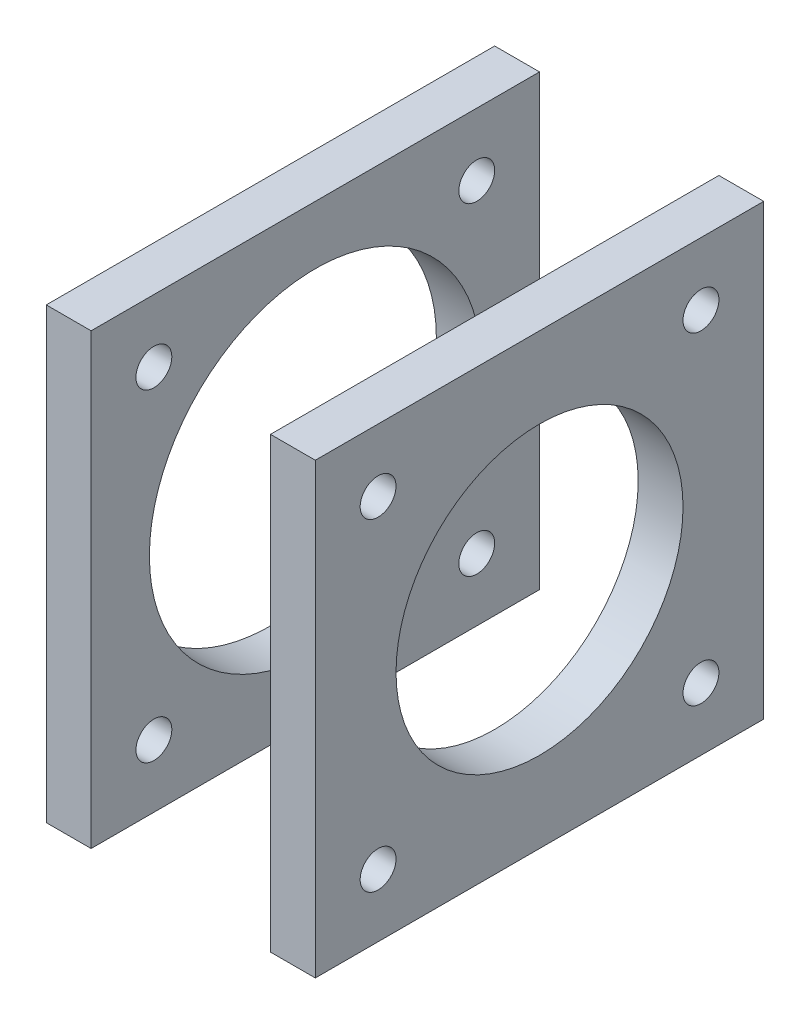
from build123d import *

# Parameters (mm, degrees)
SKETCH1_W           = 50
SKETCH1_H           = 50
SKETCH1_R           = 2
SKETCH1_R_2         = 18.5
BOSS_EXTRUDE1_DEPTH = 5
SKETCH4_W           = 50
SKETCH4_H           = 50
SKETCH4_R           = 2
SKETCH4_R_2         = 16
BOSS_EXTRUDE2_DEPTH = 5


with BuildPart() as part:
    # Sketch1 → Boss-Extrude1 (new body)
    with BuildSketch(Plane(origin=(0, 0, 0), x_dir=(0, 0, -1), z_dir=(1, 0, 0))):
        with Locations((7.569218273, -6.915532209)):
            Rectangle(SKETCH1_W, SKETCH1_H)
        with Locations((-10.430781727, 11.084467791)):
            Circle(SKETCH1_R, mode=Mode.SUBTRACT)
        with Locations(Location((-10.430781727, -24.915532209, 0), (0, 0, 180))):
            Circle(SKETCH1_R, mode=Mode.SUBTRACT)
        with Locations((25.569218273, -24.915532209)):
            Circle(SKETCH1_R, mode=Mode.SUBTRACT)
        with Locations(Location((25.569218273, 11.084467791, 0), (0, 0, 180))):
            Circle(SKETCH1_R, mode=Mode.SUBTRACT)
        with Locations((7.569218273, -6.915532209)):
            Circle(SKETCH1_R_2, mode=Mode.SUBTRACT)
    extrude(amount=BOSS_EXTRUDE1_DEPTH)


with BuildPart() as body_2:
    # Sketch4 → Boss-Extrude2 (new body)
    with BuildSketch(Plane(origin=(25, 0, 0), x_dir=(0, 0, -1), z_dir=(1, 0, 0))):
        with Locations((7.569218273, -6.915532209)):
            Rectangle(SKETCH4_W, SKETCH4_H)
        with Locations((-10.430781727, -24.915532209)):
            Circle(SKETCH4_R, mode=Mode.SUBTRACT)
        with Locations((-10.430781727, 11.084467791)):
            Circle(SKETCH4_R, mode=Mode.SUBTRACT)
        with Locations((25.569218273, 11.084467791)):
            Circle(SKETCH4_R, mode=Mode.SUBTRACT)
        with Locations((25.569218273, -24.915532209)):
            Circle(SKETCH4_R, mode=Mode.SUBTRACT)
        with Locations((7.569218273, -6.915532209)):
            Circle(SKETCH4_R_2, mode=Mode.SUBTRACT)
    extrude(amount=BOSS_EXTRUDE2_DEPTH)


solid = Compound([part.part, body_2.part])
